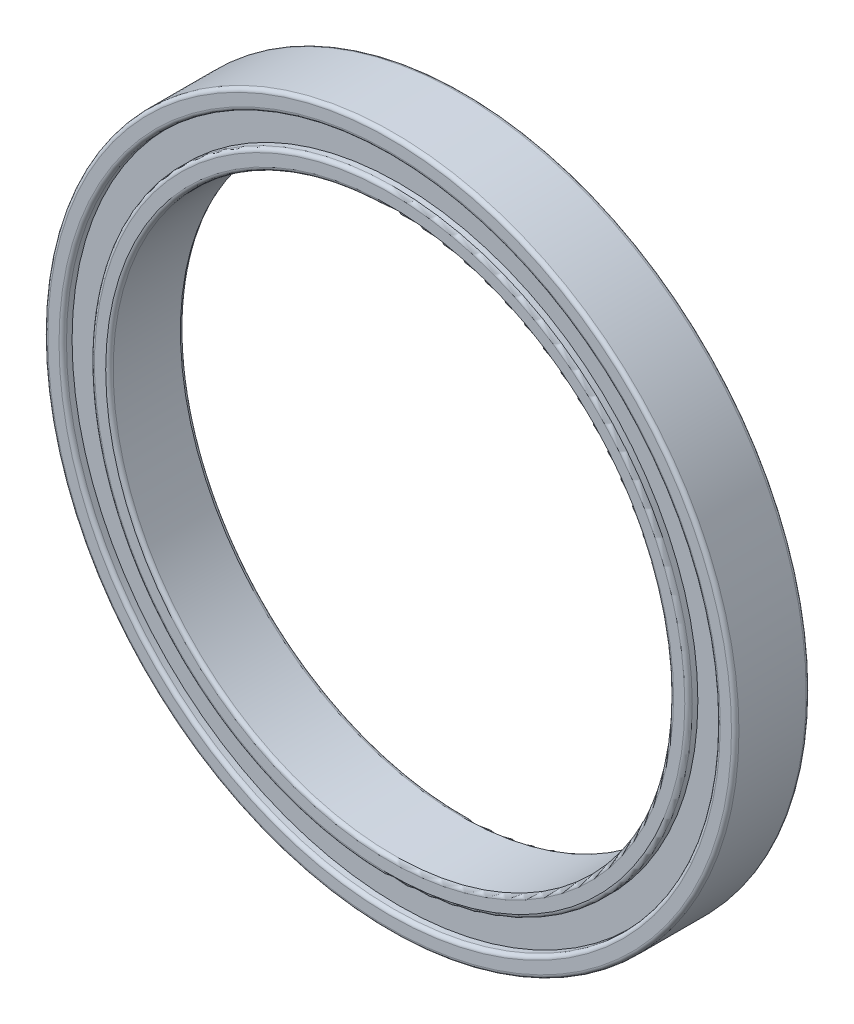
from build123d import *

# Parameters (mm, degrees)
SKETCH1_R          = 18.5
SKETCH1_R_2        = 15
EXTRUDE1_DEPTH     = 4
SKETCH2_R          = 17.5
SKETCH2_R_2        = 16
CUT_EXTRUDE1_DEPTH = 0.5
CUT_EXTRUDE2_START = -0.5
SKETCH3_R          = 17.5
SKETCH3_R_2        = 16
CUT_EXTRUDE2_DEPTH = 0.5
FILLET1_R          = 0.2


with BuildPart() as part:
    # Sketch1 → Extrude1 (new body)
    with BuildSketch(Plane.XY):
        Circle(SKETCH1_R)
        Circle(SKETCH1_R_2, mode=Mode.SUBTRACT)
    extrude(amount=EXTRUDE1_DEPTH)

    # Sketch2 → Cut-Extrude1 (cut)
    with BuildSketch(Plane.XY.offset(4)):
        Circle(SKETCH2_R)
        Circle(SKETCH2_R_2, mode=Mode.SUBTRACT)
    extrude(amount=-CUT_EXTRUDE1_DEPTH, mode=Mode.SUBTRACT)

    # Sketch3 → Cut-Extrude2 (cut)
    with BuildSketch(Plane(origin=(0, 0, 0), x_dir=(-1, 0, 0), z_dir=(0, 0, -1)).offset(CUT_EXTRUDE2_START)):
        with Locations(Location((0, 0, 0), (0, 0, 180))):
            Circle(SKETCH3_R)
        with Locations(Location((0, 0, 0), (0, 0, 180))):
            Circle(SKETCH3_R_2, mode=Mode.SUBTRACT)
    extrude(amount=CUT_EXTRUDE2_DEPTH, mode=Mode.SUBTRACT)

    # Fillet1
    fillet1_edges = [part.edges().sort_by_distance(p)[0] for p in [
        (-17.5, 0, 4),
        (-16, 0, 4),
        (-18.5, 0, 0),
        (-17.5, 0, 0),
        (-16, 0, 0),
        (-18.5, 0, 4),
        (-15, 0, 0),
        (-15, 0, 4),
    ]]
    fillet(fillet1_edges, radius=FILLET1_R)


solid = part.part
